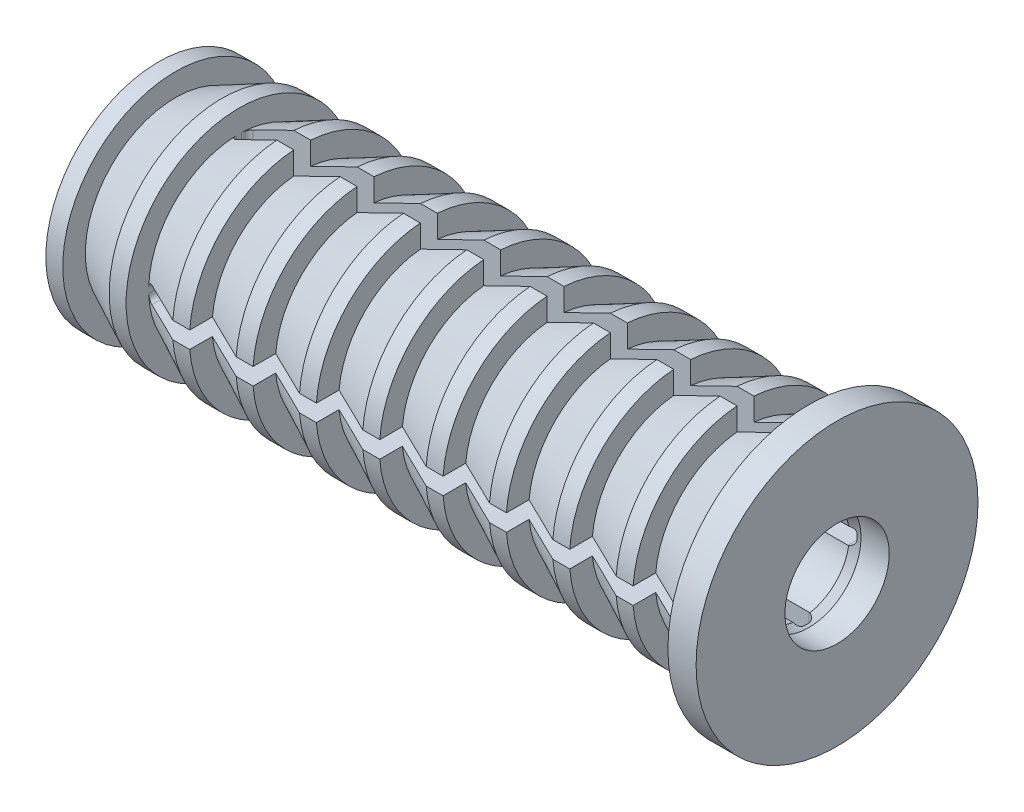
from build123d import *

# Parameters (mm, degrees)
CUT_EXTRUDE2_DEPTH      = 13.509996003
CUT_EXTRUDE2_DEPTH_BACK = 13.509996003
CUT_EXTRUDE3_DEPTH      = 13.509996003
CUT_EXTRUDE3_DEPTH_BACK = 13.509996003


with BuildPart() as part:
    # Sketch2 → Revolve2 (revolve)
    with BuildSketch(Plane.XY, mode=Mode.PRIVATE) as revolve2_sk:
        Polygon((-12, 1), (-11.533692342, 2), (-11.233692342, 2), (-11.233692342, 1.6), (-10.410323108, 2), (-10.110323108, 2), (-10.110323108, 1.6), (-9.286953873, 2), (-8.986953873, 2), (-8.986953873, 1.6), (-8.163584639, 2), (-7.863584639, 2), (-7.863584639, 1.6), (-7.040215405, 2), (-6.740215405, 2), (-6.740215405, 1.6), (-5.916846171, 2), (-5.616846171, 2), (-5.616846171, 1.6), (-4.793476937, 2), (-4.493476937, 2), (-4.493476937, 1.6), (-3.670107703, 2), (-3.370107703, 2), (-3.370107703, 1.6), (-2.546738468, 2), (-2.246738468, 2), (-2.246738468, 1.6), (-1.423369234, 2), (-1.123369234, 2), (-1.123369234, 1.6), (-0.3, 2), (0, 2), (0, 2.5), (0.5, 2.5), (0.5, 0.925), (0, 0.925), (-0.129903811, 0.85), (-11.740192379, 0.85), align=None)
    revolve(revolve2_sk.sketch.rotate(Axis((0, 0, 0), (-1, 0, 0)), 90), axis=Axis((0, 0, 0), (-1, 0, 0)))

    # Sketch4 → Cut-Extrude2 (cut, two sides: drawn at the far end of the back side and taken through both)
    with BuildSketch(Plane(origin=(0, 0, 0), x_dir=(1, 0, 0), z_dir=(0, 1, 0)).offset(-CUT_EXTRUDE2_DEPTH_BACK)):
        with BuildLine():
            Line((-10.010323108, -0.15), (-0.14330127, -0.15))
            ThreePointArc((-0.14330127, -0.15), (-0.072590592, -0.120710678), (-0.04330127, -0.05))
            Line((-0.04330127, -0.05), (-0.04330127, 0.05))
            ThreePointArc((-0.04330127, 0.05), (-0.072590592, 0.120710678), (-0.14330127, 0.15))
            Line((-0.14330127, 0.15), (-10.010323108, 0.15))
            ThreePointArc((-10.010323108, 0.15), (-10.081033786, 0.120710678), (-10.110323108, 0.05))
            Line((-10.110323108, 0.05), (-10.110323108, -0.05))
            ThreePointArc((-10.110323108, -0.05), (-10.081033786, -0.120710678), (-10.010323108, -0.15))
        make_face()
    extrude(amount=CUT_EXTRUDE2_DEPTH + CUT_EXTRUDE2_DEPTH_BACK, mode=Mode.SUBTRACT)

    # Sketch5 → Cut-Extrude3 (cut, two sides: drawn at the far end of the back side and taken through both)
    with BuildSketch(Plane.XY.offset(-CUT_EXTRUDE3_DEPTH_BACK)):
        with BuildLine():
            Line((-0.14330127, -0.15), (-10.010323108, -0.15))
            ThreePointArc((-10.010323108, -0.15), (-10.081033786, -0.120710678), (-10.110323108, -0.05))
            Line((-10.110323108, -0.05), (-10.110323108, 0.05))
            ThreePointArc((-10.110323108, 0.05), (-10.081033786, 0.120710678), (-10.010323108, 0.15))
            Line((-10.010323108, 0.15), (-0.14330127, 0.15))
            ThreePointArc((-0.14330127, 0.15), (-0.072590592, 0.120710678), (-0.04330127, 0.05))
            Line((-0.04330127, 0.05), (-0.04330127, -0.05))
            ThreePointArc((-0.04330127, -0.05), (-0.072590592, -0.120710678), (-0.14330127, -0.15))
        make_face()
    extrude(amount=CUT_EXTRUDE3_DEPTH + CUT_EXTRUDE3_DEPTH_BACK, mode=Mode.SUBTRACT)


solid = part.part
